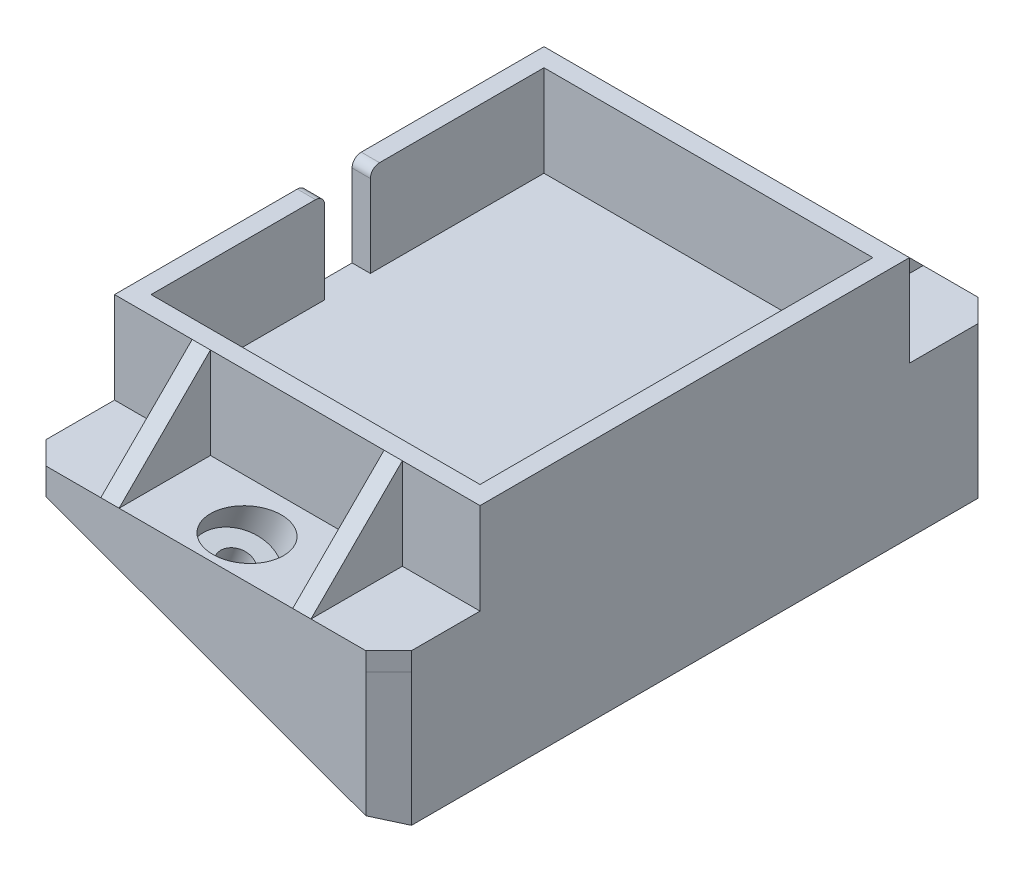
from build123d import *

# Parameters (mm, degrees)
SKETCH1_W                       = 80
SKETCH1_H                       = 94
SKETCH1_W_2                     = 72
SKETCH1_H_2                     = 86
BOSS_EXTRUDE3_DEPTH             = 20
SKETCH10_W                      = 80
SKETCH10_H                      = 134
BOSS_EXTRUDE4_DEPTH             = 4
CUT_EXTRUDE1_REACH              = 108.25
SKETCH11_W                      = 10
SKETCH11_H                      = 20
FILLET2_R                       = 2
RIB10_REACH                     = 94.79
SKETCH26_WALL_W                 = 215.864442602
SKETCH26_WALL_H                 = 4
MIRROR4_COPY_1_REACH            = 94.79
MIRROR4_COPY_1_SKETCH_W         = 215.864442602
MIRROR4_COPY_1_SKETCH_H         = 4
CHAMFER1_SIZE                   = 5
BOSS_EXTRUDE6_REACH             = 82.554
BOSS_EXTRUDE6_DIRECTION_2_REACH = 82.554
CHAMFER2_SIZE                   = 5
CUT_EXTRUDE2_DEPTH              = 10
SKETCH32_R                      = 7.5
CUT_EXTRUDE3_DEPTH              = 20
SKETCH33_R                      = 3.4
CUT_EXTRUDE5_DEPTH              = 10


with BuildPart() as part:
    # Sketch1 → Boss-Extrude3 (new body)
    with BuildSketch(Plane(origin=(0, 0, 0), x_dir=(1, 0, 0), z_dir=(0, 1, 0))):
        Rectangle(SKETCH1_W, SKETCH1_H)
        Rectangle(SKETCH1_W_2, SKETCH1_H_2, mode=Mode.SUBTRACT)
    extrude(amount=BOSS_EXTRUDE3_DEPTH)

    # Sketch10 → Boss-Extrude4 (add)
    with BuildSketch(Plane.XZ):
        Rectangle(SKETCH10_W, SKETCH10_H)
    extrude(amount=BOSS_EXTRUDE4_DEPTH)

    # Sketch11 → Cut-Extrude1 (cut, up to next)
    with BuildSketch(Plane.ZY.offset(40), mode=Mode.PRIVATE) as cut_extrude1_sk1:
        with Locations((0, 10)):
            Rectangle(SKETCH11_W, SKETCH11_H)
    cut_extrude1_tool1 = extrude(cut_extrude1_sk1.sketch, amount=-CUT_EXTRUDE1_REACH, mode=Mode.PRIVATE) & part.part
    add(cut_extrude1_tool1.solids().sort_by_distance((-40, 10, 0))[0], mode=Mode.SUBTRACT)

    # Fillet2
    fillet2_edges = [part.edges().sort_by_distance(p)[0] for p in [
        (-38, 20, 5),
        (-38, 20, -5),
    ]]
    fillet(fillet2_edges, radius=FILLET2_R)

    # Sketch26 wall → Rib10 (add, up to next)
    with BuildSketch(Plane(origin=(-21, 10, -57), x_dir=(0, 0.707106781187, 0.707106781187), z_dir=(0, 0.707106781187, -0.707106781187)), mode=Mode.PRIVATE) as rib10_sk1:
        Rectangle(SKETCH26_WALL_W, SKETCH26_WALL_H)
    rib10_tool1 = extrude(rib10_sk1.sketch, amount=-RIB10_REACH, mode=Mode.PRIVATE) - part.part
    rib10 = rib10_tool1.solids().sort_by_distance((-21, 10, -57))[0]
    add(rib10)

    # Mirror3: Rib10 across plane
    add(rib10.mirror(Plane(origin=(0, 0, 0), x_dir=(0, 0, 1), z_dir=(1, 0, 0))))

    # Mirror4: Rib10 across plane
    add(rib10.mirror(Plane.XY))

    # Mirror4 copy 1 sketch → Mirror4 copy 1 (add, up to next)
    with BuildSketch(Plane(origin=(21, 10, 57), x_dir=(0, 0.707106781187, -0.707106781187), z_dir=(0, 0.707106781187, 0.707106781187)), mode=Mode.PRIVATE) as mirror4_copy_1_sk1:
        Rectangle(MIRROR4_COPY_1_SKETCH_W, MIRROR4_COPY_1_SKETCH_H)
    mirror4_copy_1_tool1 = extrude(mirror4_copy_1_sk1.sketch, amount=-MIRROR4_COPY_1_REACH, mode=Mode.PRIVATE) - part.part
    add(mirror4_copy_1_tool1.solids().sort_by_distance((21, 10, 57))[0])

    # Chamfer1
    chamfer1_edges = [part.edges().sort_by_distance(p)[0] for p in [
        (40, -2, -67),
        (40, -2, 67),
        (-40, -2, 67),
        (-40, -2, -67),
    ]]
    chamfer(chamfer1_edges, length=CHAMFER1_SIZE)

    # Boss-Extrude6: up to this face of the body (flat: up to its plane)
    boss_extrude6_end = Plane(part.part.faces().sort_by_distance((0, -2, 67))[0])
    # Sketch29 → Boss-Extrude6 (add, up to the picked face)
    with BuildSketch(Plane.XY, mode=Mode.PRIVATE) as boss_extrude6_sk1:
        Polygon((40, -4), (35, -4), (-35, -4), (-40, -4), (40, -33.117618741), align=None)
    boss_extrude6_tool1 = split(extrude(boss_extrude6_sk1.sketch, amount=BOSS_EXTRUDE6_REACH, mode=Mode.PRIVATE), bisect_by=boss_extrude6_end, keep=Keep.BOTH, mode=Mode.PRIVATE)
    add(boss_extrude6_tool1.solids().sort_by(Axis((13.333333, -13.705873, 0), (0, 0, 1)))[0])

    # Boss-Extrude6 direction 2: up to this face of the body (flat: up to its plane)
    boss_extrude6_direction_2_end = Plane(part.part.faces().sort_by_distance((0, -2, -67))[0])
    # Sketch29 → Boss-Extrude6 direction 2 (add, up to the picked face)
    with BuildSketch(Plane.XY, mode=Mode.PRIVATE) as boss_extrude6_direction_2_sk1:
        Polygon((40, -4), (35, -4), (-35, -4), (-40, -4), (40, -33.117618741), align=None)
    boss_extrude6_direction_2_tool1 = split(extrude(boss_extrude6_direction_2_sk1.sketch, amount=-BOSS_EXTRUDE6_DIRECTION_2_REACH, mode=Mode.PRIVATE), bisect_by=boss_extrude6_direction_2_end, keep=Keep.BOTH, mode=Mode.PRIVATE)
    add(boss_extrude6_direction_2_tool1.solids().sort_by(Axis((13.333333, -13.705873, 0), (0, 0, -1)))[0])

    # Chamfer2
    chamfer2_edges = [part.edges().sort_by_distance(p)[0] for p in [
        (40, -18.558809371, -67),
        (40, -18.558809371, 67),
    ]]
    chamfer(chamfer2_edges, length=CHAMFER2_SIZE)

    # Sketch30 → Cut-Extrude2 (cut)
    with BuildSketch(Plane(origin=(0, -4, 0), x_dir=(1, 0, 0), z_dir=(0, 1, 0))):
        Polygon((-40, -67), (-35, -67), (-40, -62), align=None)
        Polygon((-40, 67), (-40, 62), (-35, 67), align=None)
    extrude(amount=-CUT_EXTRUDE2_DEPTH, mode=Mode.SUBTRACT)

    # Sketch32 → Cut-Extrude3 (cut)
    with BuildSketch(Plane(origin=(4.295917943, 11.802937544, 0), x_dir=(-0.9396926207859082, 0.3420201433256692, 0), z_dir=(-0.3420201433256692, -0.9396926207859082, 0))):
        with Locations(Location((0, 58, 0), (0, 0, 180))):
            Circle(SKETCH32_R)
    cut_extrude3 = extrude(amount=CUT_EXTRUDE3_DEPTH, mode=Mode.SUBTRACT)

    # Sketch33 → Cut-Extrude5 (cut)
    with BuildSketch(Plane(origin=(-2.544484924, -6.990914872, 0), x_dir=(0.9396926207859082, -0.3420201433256692, 0), z_dir=(0.3420201433256692, 0.9396926207859082, 0))):
        with Locations(Location((0, 58, 0), (0, 0, 180))):
            Circle(SKETCH33_R)
    cut_extrude5 = extrude(amount=-CUT_EXTRUDE5_DEPTH, mode=Mode.SUBTRACT)

    # Mirror5: Cut-Extrude3, Cut-Extrude5 across plane
    add(cut_extrude3.mirror(Plane.XY), mode=Mode.SUBTRACT)
    add(cut_extrude5.mirror(Plane.XY), mode=Mode.SUBTRACT)


solid = part.part
